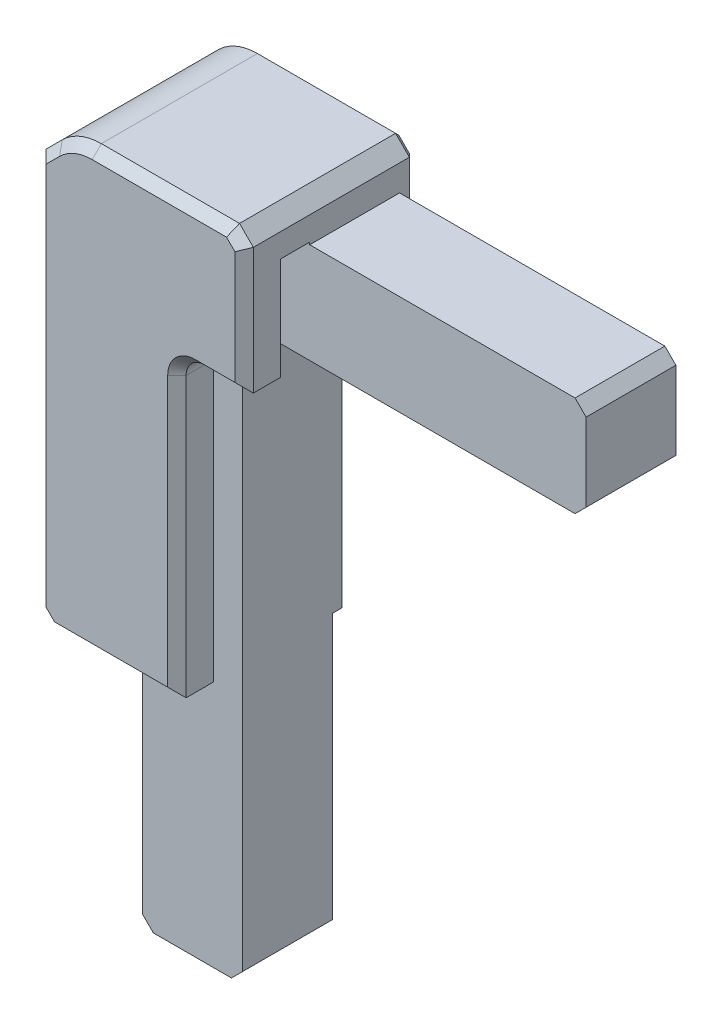
from build123d import *

# Parameters (mm, degrees)
BODY_DEPTH                  = 5.71
SIDE_TONGUE_SKETCH_W        = 10.88
SIDE_TONGUE_SKETCH_H        = 31
SIDE_TONGUE_DEPTH           = 4.875
END_TONGUE_SKETCH_W         = 31
END_TONGUE_SKETCH_H         = 10.88
END_TONGUE_DEPTH            = 4.875
WEB_DEPTH                   = 9.27
LIP_DEPTH                   = 1.985
INSERT_HOLES_SKETCH_R       = 2.15
INSERT_HOLES_DEPTH          = 4.5
BUMPER_CORNER_BED_SIDE_SIZE = 3.516
BUMPER_CORNER_R             = 6
INSIDE_CORNER_OF_THE_WEB_R  = 1
REVEAL_CORNER_R             = 2
BODY_INSIDE_CORNER_R        = 2
ARM_ENDS_SIZE               = 1.5
TONGUE_LEAD_IN_SIZE         = 1.2
FRONT_FACE_CHAMFER_SIZE     = 1
BACK_FACE_CHAMFER_SIZE      = 0.6


with BuildPart() as part:
    # body sketch → body (new, symmetric)
    with BuildSketch(Plane.XY.offset(19.54)):
        Polygon((-4.42, 7.07), (18.08, 7.07), (18.08, -8.13), (10.78, -8.13), (10.78, -40.43), (-4.42, -40.43), align=None)
    extrude(amount=BODY_DEPTH, both=True)

    # side tongue sketch → side tongue (add, symmetric)
    with BuildSketch(Plane.XY.offset(20.375)):
        with Locations((5.34, -54.93)):
            Rectangle(SIDE_TONGUE_SKETCH_W, SIDE_TONGUE_SKETCH_H)
    extrude(amount=SIDE_TONGUE_DEPTH, both=True)

    # end tongue sketch → end tongue (add, symmetric)
    with BuildSketch(Plane.XY.offset(20.375)):
        with Locations((32.58, -2.69)):
            Rectangle(END_TONGUE_SKETCH_W, END_TONGUE_SKETCH_H)
    extrude(amount=END_TONGUE_DEPTH, both=True)

    # web sketch → web (add, symmetric)
    with BuildSketch(Plane.XY.offset(23.1)):
        Polygon((-4.42, 7.07), (18.08, 7.07), (18.08, 3), (-0.35, 3), (-0.35, -40.43), (-4.42, -40.43), align=None)
    extrude(amount=WEB_DEPTH, both=True)

    # lip sketch → lip (add, symmetric)
    with BuildSketch(Plane.XY.offset(30.385)):
        Polygon((-4.42, 7.07), (18.08, 7.07), (18.08, -8.13), (10.78, -8.13), (10.78, -40.43), (-4.42, -40.43), align=None)
    extrude(amount=LIP_DEPTH, both=True)

    # insert holes sketch → insert holes (cut, symmetric)
    with BuildSketch(Plane(origin=(-0.92, 0, 0), x_dir=(0, 0, -1), z_dir=(1, 0, 0))):
        with Locations((-19.54, -28.7)):
            Circle(INSERT_HOLES_SKETCH_R)
        with Locations((-19.54, -12.7)):
            Circle(INSERT_HOLES_SKETCH_R)
    extrude(amount=INSERT_HOLES_DEPTH, both=True, mode=Mode.SUBTRACT)

    # bumper corner, bed side
    bumper_corner_bed_side_edges = [part.edges().sort_by_distance(p)[0] for p in [
        (-4.42, 7.07, 23.1),
    ]]
    chamfer(bumper_corner_bed_side_edges, length=BUMPER_CORNER_BED_SIDE_SIZE)

    # bumper corner
    bumper_corner_edges = [part.edges().sort_by_distance(p)[0] for p in [
        (-0.904, 7.07, 23.1),
    ]]
    fillet(bumper_corner_edges, radius=BUMPER_CORNER_R)

    # inside corner of the web
    inside_corner_of_the_web_edges = [part.edges().sort_by_distance(p)[0] for p in [
        (-0.35, 3, 26.825),
    ]]
    fillet(inside_corner_of_the_web_edges, radius=INSIDE_CORNER_OF_THE_WEB_R)

    # reveal corner
    reveal_corner_edges = [part.edges().sort_by_distance(p)[0] for p in [
        (10.78, -8.13, 30.385),
    ]]
    fillet(reveal_corner_edges, radius=REVEAL_CORNER_R)

    # body inside corner
    body_inside_corner_edges = [part.edges().sort_by_distance(p)[0] for p in [
        (10.78, -8.13, 19.54),
    ]]
    fillet(body_inside_corner_edges, radius=BODY_INSIDE_CORNER_R)

    # arm ends
    arm_ends_edges = [part.edges().sort_by_distance(p)[0] for p in [
        (18.08, 7.07, 23.1),
        (-4.42, -40.43, 23.1),
    ]]
    chamfer(arm_ends_edges, length=ARM_ENDS_SIZE)

    # tongue lead-in
    tongue_lead_in_edges = [part.edges().sort_by_distance(p)[0] for p in [
        (10.78, -70.43, 20.375),
        (-0.1, -70.43, 20.375),
        (48.08, 2.75, 20.375),
        (48.08, -8.13, 20.375),
    ]]
    chamfer(tongue_lead_in_edges, length=TONGUE_LEAD_IN_SIZE)

    # front face chamfer
    front_face_chamfer_edges = [part.edges().sort_by_distance(p)[0] for p in [
        (10.78, -25.28, 32.37),
        (-4.42, -17.688, 32.37),
        (-3.540679656, 4.433320344, 32.37),
        (-0.71481922, 6.613277195, 32.37),
        (15.43, -8.13, 32.37),
        (11.365786438, -8.715786438, 32.37),
        (9.080640687, 7.07, 32.37),
        (3.93, -40.43, 32.37),
        (-3.67, -39.68, 32.37),
        (17.33, 6.32, 32.37),
        (18.08, -1.28, 32.37),
    ]]
    chamfer(front_face_chamfer_edges, length=FRONT_FACE_CHAMFER_SIZE)

    # back face chamfer
    back_face_chamfer_edges = [part.edges().sort_by_distance(p)[0] for p in [
        (-4.42, -17.688, 13.83),
        (-3.540679656, 4.433320344, 13.83),
        (-0.71481922, 6.613277195, 13.83),
        (15.43, -8.13, 13.83),
        (11.365786438, -8.715786438, 13.83),
        (9.080640687, 7.07, 13.83),
        (3.93, -40.43, 13.83),
        (-3.67, -39.68, 13.83),
        (17.33, 6.32, 13.83),
        (18.08, -1.28, 13.83),
        (10.78, -25.28, 13.83),
    ]]
    chamfer(back_face_chamfer_edges, length=BACK_FACE_CHAMFER_SIZE)


solid = part.part
